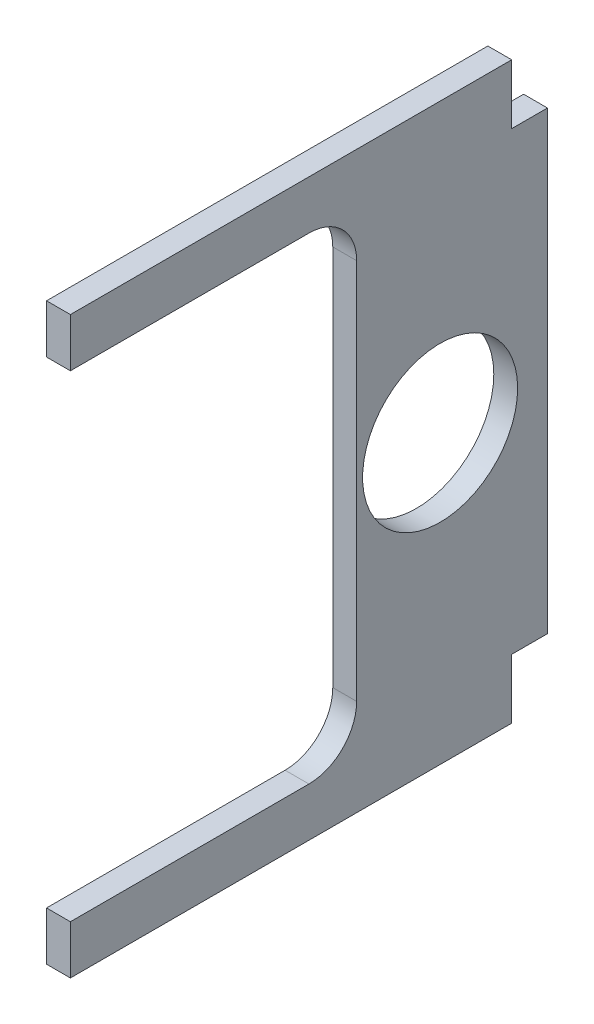
from build123d import *

# Parameters (mm, degrees)
ESTRUSIONE_ESTRUSIONE1_DEPTH      = 13
ESTRUSIONE_ESTRUSIONE1_DEPTH_BACK = 3
SCHIZZO1_W                        = 2
SCHIZZO1_H                        = 38.172865154
SCHIZZO2_W                        = 2
SCHIZZO2_H                        = 37
ESTRUSIONE_ESTRUSIONE2_DEPTH      = 5
SCHIZZO3_W                        = 24
SCHIZZO3_H                        = 0.913567423
TAGLIO_ESTRUSIONE1_DEPTH          = 10
RACCORDO1_R                       = 4
RACCORDO1_OF_SPECCHIA1_R          = 4
SCHIZZO4_R                        = 6.5
TAGLIO_ESTRUSIONE2_DEPTH          = 10


with BuildPart() as part:
    # Schizzo1 → Estrusione-Estrusione1 (new, two sides: drawn at the far end of the back side and taken through both)
    with BuildSketch(Plane.XY.offset(-ESTRUSIONE_ESTRUSIONE1_DEPTH_BACK)):
        with Locations((-240, 0)):
            Rectangle(SCHIZZO1_W, SCHIZZO1_H)
    extrude(amount=ESTRUSIONE_ESTRUSIONE1_DEPTH + ESTRUSIONE_ESTRUSIONE1_DEPTH_BACK)

    # Schizzo2 → Estrusione-Estrusione2 (add)
    with BuildSketch(Plane(origin=(0, 19.086432577, 0), x_dir=(1, 0, 0), z_dir=(0, 1, 0))):
        with Locations((-240, -18.5)):
            Rectangle(SCHIZZO2_W, SCHIZZO2_H)
    estrusione_estrusione2 = extrude(amount=ESTRUSIONE_ESTRUSIONE2_DEPTH)

    # Schizzo3 → Taglio-Estrusione1 (cut)
    with BuildSketch(Plane(origin=(-239, 0, 0), x_dir=(0, 0, -1), z_dir=(1, 0, 0))):
        with Locations((-25, 19.543216288)):
            Rectangle(SCHIZZO3_W, SCHIZZO3_H)
    taglio_estrusione1 = extrude(amount=-TAGLIO_ESTRUSIONE1_DEPTH, mode=Mode.SUBTRACT)

    # Raccordo1
    raccordo1_edges = [part.edges().sort_by_distance(p)[0] for p in [
        (-240, 20, 13),
    ]]
    fillet(raccordo1_edges, radius=RACCORDO1_R)

    # Specchia1: Estrusione-Estrusione2, Taglio-Estrusione1 across plane
    add(estrusione_estrusione2.mirror(Plane.ZX))
    add(taglio_estrusione1.mirror(Plane.ZX), mode=Mode.SUBTRACT)

    # Raccordo1 of Specchia1
    raccordo1_of_specchia1_edges = [part.edges().sort_by_distance(p)[0] for p in [
        (-240, -20, 13),
    ]]
    fillet(raccordo1_of_specchia1_edges, radius=RACCORDO1_OF_SPECCHIA1_R)

    # Schizzo4 → Taglio-Estrusione2 (cut)
    with BuildSketch(Plane(origin=(-239, 0, 0), x_dir=(0, 0, -1), z_dir=(1, 0, 0))):
        with Locations((-6, 0)):
            Circle(SCHIZZO4_R)
    extrude(amount=-TAGLIO_ESTRUSIONE2_DEPTH, mode=Mode.SUBTRACT)


solid = part.part
